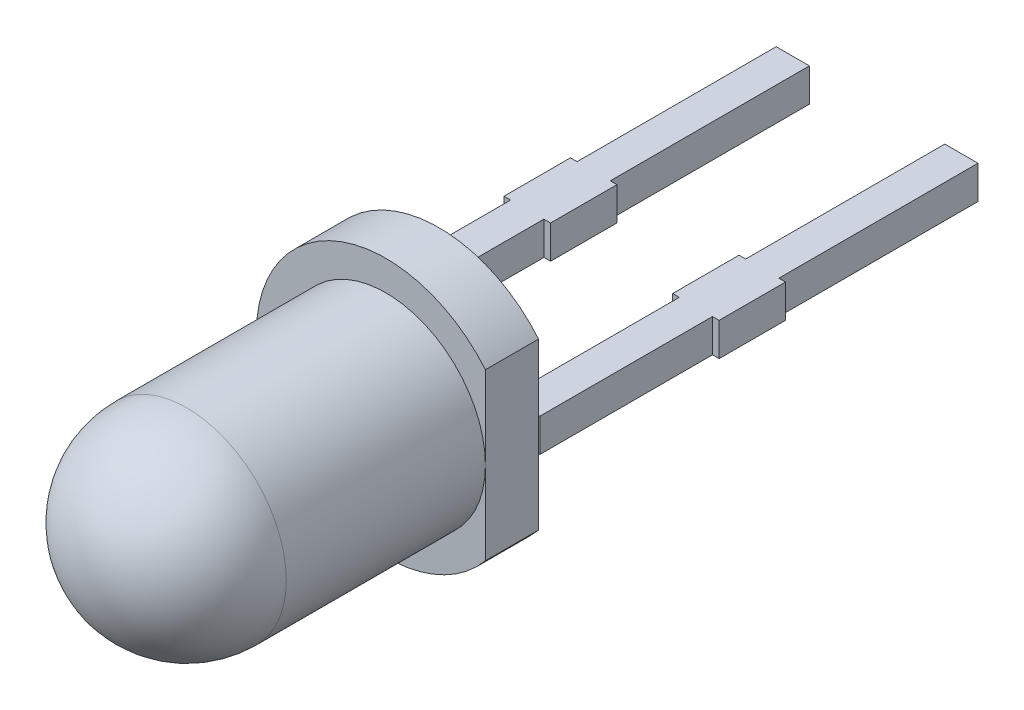
from build123d import *

# Parameters (mm, degrees)
EXTRUDE_1_DEPTH     = 0.25
EXTRUDE_1_2_DEPTH   = 0.25
CUT_EXTRUDE_START   = -0.8
CUT_EXTRUDE_1_DEPTH = 0.8


with BuildPart() as part:
    # Эскиз1 → Бобышка-Вытянуть1 (new, symmetric)
    with BuildSketch(Plane.XZ):
        Polygon((-1.52, 3.6), (-1.52, 1), (-1.62, 1), (-1.62, 0), (-1.52, 0), (-1.52, -3), (-1.02, -3), (-1.02, 0), (-0.92, 0), (-0.92, 1), (-1.02, 1), (-1.02, 3.6), align=None)
    extrude(amount=EXTRUDE_1_DEPTH, both=True)



with BuildPart() as body_2:
    # Эскиз1 → Extrude 1 2 (new, symmetric)
    with BuildSketch(Plane.XZ):
        Polygon((1.02, 3.6), (1.02, 1), (0.92, 1), (0.92, 0), (1.02, 0), (1.02, -3), (1.52, -3), (1.52, 0), (1.62, 0), (1.62, 1), (1.52, 1), (1.52, 3.6), align=None)
    extrude(amount=EXTRUDE_1_2_DEPTH, both=True)


with BuildPart() as part_1:
    add(part.part)

    add(body_2.part)  # Повернуть1 merges body 2
    # Эскиз2 → Повернуть1 (revolve)
    with BuildSketch(Plane(origin=(0, 0, 0), x_dir=(1, 0, 0), z_dir=(0, 1, 0))):
        with BuildLine():
            Line((0, -3.6), (0, -8.9))
            ThreePointArc((0, -8.9), (1.060660172, -8.460660172), (1.5, -7.4))
            Line((1.5, -7.4), (1.5, -4.4))
            Line((1.5, -4.4), (1.95, -4.4))
            Line((1.95, -4.4), (1.95, -3.6))
            Line((1.95, -3.6), (0, -3.6))
        make_face()
    revolve(axis=Axis((0, 0, 3.6), (0, 0, -1)))

    # Эскиз3 → Вырез-Вытянуть1 (cut)
    with BuildSketch(Plane.XY.offset(4.4).offset(CUT_EXTRUDE_START)):
        with BuildLine():
            Line((1.5, 1.245993579), (1.5, -1.245993579))
            ThreePointArc((1.5, -1.245993579), (1.95, 0), (1.5, 1.245993579))
        make_face()
    extrude(amount=CUT_EXTRUDE_1_DEPTH, mode=Mode.SUBTRACT)


solid = part_1.part
